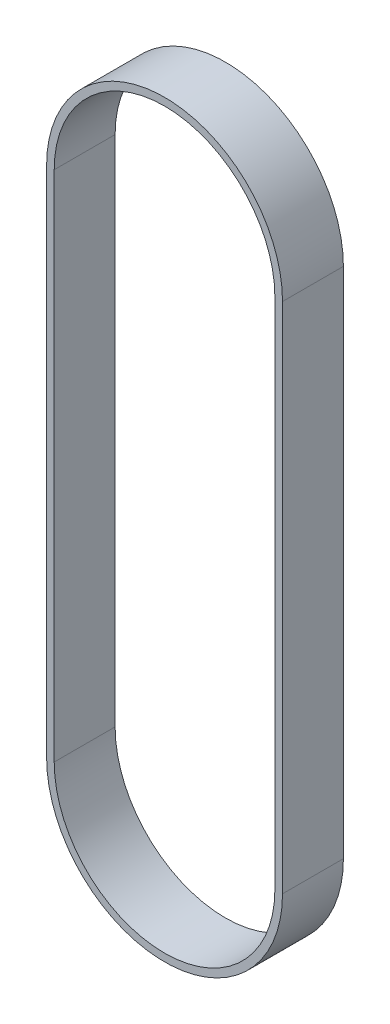
from build123d import *

# Parameters (mm, degrees)
EXTRUDE_THIN1_DEPTH = 20


with BuildPart() as part:
    # Sketch2 → Extrude-Thin1 (new body)
    with BuildSketch(Plane.XY):
        with BuildLine():
            Line((-38.741875, -168.48225), (-38.741875, 0))
            ThreePointArc((-38.741875, 0), (0, 38.741875), (38.741875, 0))
            Line((38.741875, 0), (38.741875, -168.48225))
            ThreePointArc((38.741875, -168.48225), (0, -207.224125), (-38.741875, -168.48225))
        make_face()
        with BuildLine():
            Line((-36.241875, -168.48225), (-36.241875, 0))
            ThreePointArc((-36.241875, 0), (0, 36.241875), (36.241875, 0))
            Line((36.241875, 0), (36.241875, -168.48225))
            ThreePointArc((36.241875, -168.48225), (0, -204.724125), (-36.241875, -168.48225))
        make_face(mode=Mode.SUBTRACT)
    extrude(amount=EXTRUDE_THIN1_DEPTH)


solid = part.part
